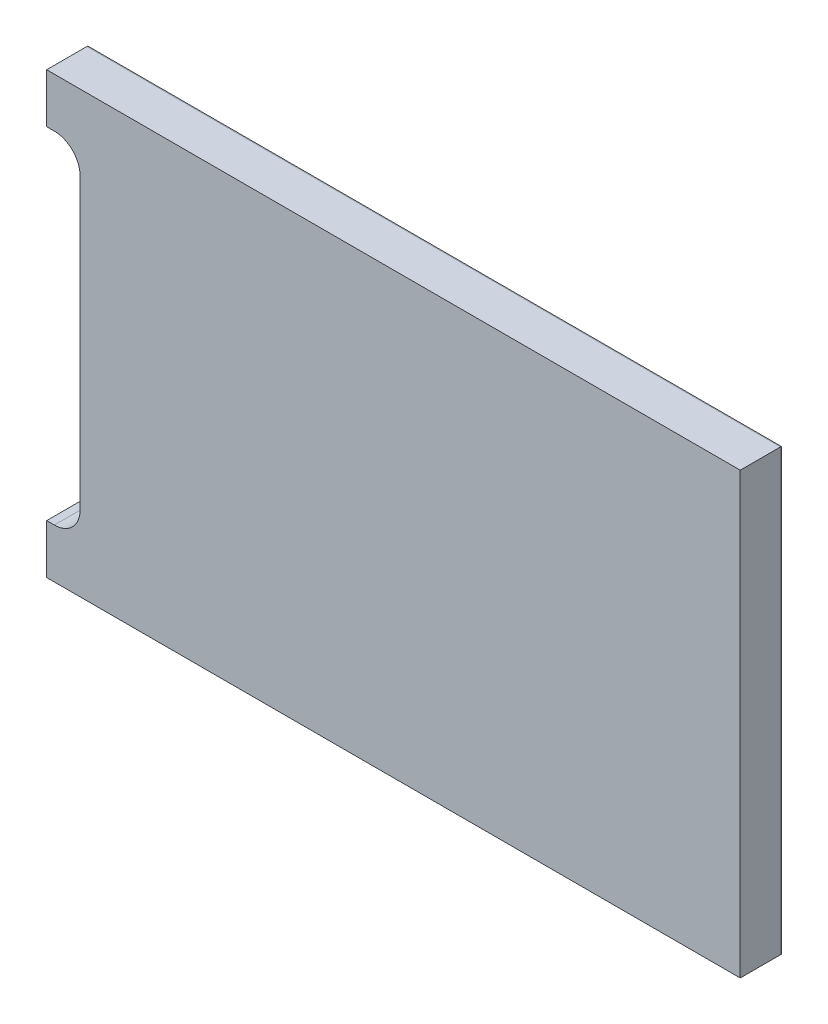
from build123d import *

# Parameters (mm, degrees)
BOSS_EXTRUDE1_DEPTH = 1.565
FILLET2_R           = 1
FILLET3_R           = 1
SKETCH4_W           = 0.035
SKETCH4_H           = 17.120447321
BOSS_EXTRUDE2_DEPTH = 27
CUT_EXTRUDE2_DEPTH  = 27


with BuildPart() as part:
    # Sketch1 → Boss-Extrude1 (new body)
    with BuildSketch(Plane.XY):
        Polygon((0, 0), (27, 0), (27, 17.120447321), (0, 17.120447321), (0, 15.2), (1.3, 15.2), (1.3, 1.920447321), (0, 1.920447321), align=None)
    extrude(amount=BOSS_EXTRUDE1_DEPTH)

    # Fillet2
    fillet2_edges = [part.edges().sort_by_distance(p)[0] for p in [
        (1.3, 15.2, 0.7825),
    ]]
    fillet(fillet2_edges, radius=FILLET2_R)

    # Fillet3
    fillet3_edges = [part.edges().sort_by_distance(p)[0] for p in [
        (1.3, 1.920447321, 0.7825),
    ]]
    fillet(fillet3_edges, radius=FILLET3_R)


with BuildPart() as body_2:
    # Sketch4 → Boss-Extrude2 (new body)
    with BuildSketch(Plane(origin=(27, 0, 0), x_dir=(0, 0, -1), z_dir=(1, 0, 0))):
        with Locations((0.0525, 8.560223661)):
            Rectangle(SKETCH4_W, SKETCH4_H)
    extrude(amount=-BOSS_EXTRUDE2_DEPTH)

    # Sketch5 → Cut-Extrude2 (cut)
    with BuildSketch(Plane.XY.offset(-0.035)):
        with BuildLine():
            Line((1.3, 2.920447321), (1.3, 14.2))
            ThreePointArc((1.3, 14.2), (1.007106781, 14.907106781), (0.3, 15.2))
            Line((0.3, 15.2), (0, 15.2))
            Line((0, 15.2), (0, 1.920447321))
            Line((0, 1.920447321), (0.3, 1.920447321))
            ThreePointArc((0.3, 1.920447321), (1.007106781, 2.213340539), (1.3, 2.920447321))
        make_face()
    extrude(amount=-CUT_EXTRUDE2_DEPTH, mode=Mode.SUBTRACT)


with BuildPart() as body_3:
    # Mirror1: mirrored copy
    add(body_2.part.mirror(Plane(origin=(0, 17.120447321, -0.035), x_dir=(1, 0, 0), z_dir=(0, 0, 1))))


solid = Compound([part.part, body_3.part])
